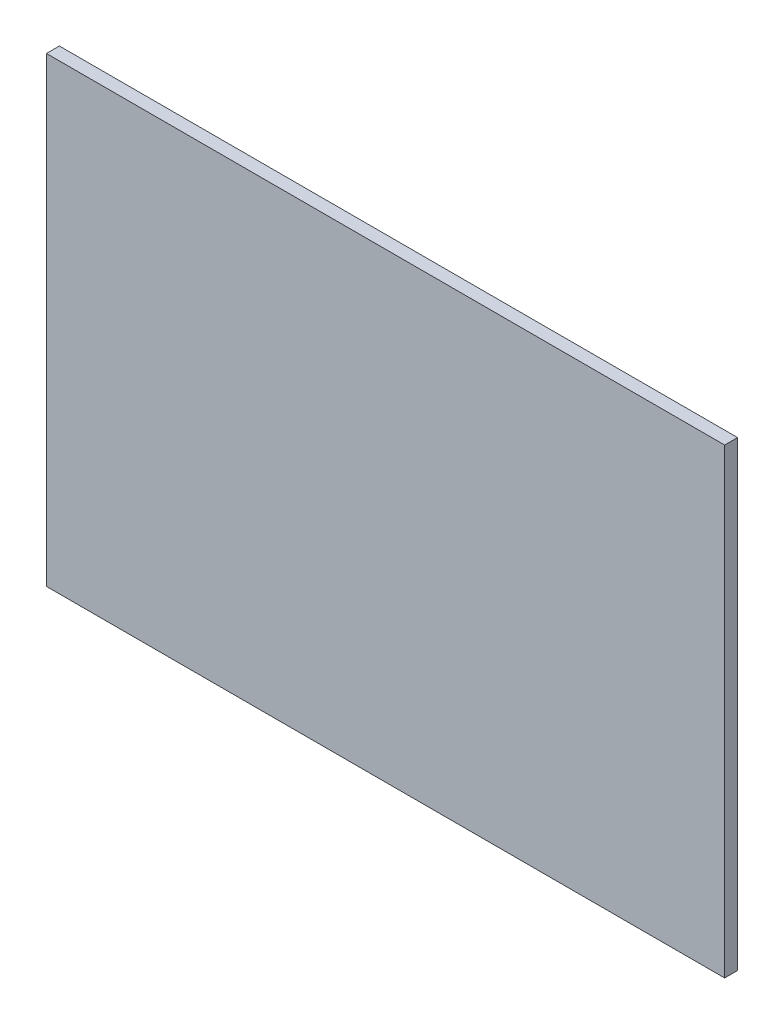
from build123d import *

# Parameters (mm, degrees)
SKETCH1_W           = 1000
SKETCH1_H           = 680.6
BOSS_EXTRUDE1_DEPTH = 19.05


with BuildPart() as part:
    # Sketch1 → Boss-Extrude1 (new body)
    with BuildSketch(Plane.XY):
        with Locations((-170, 373)):
            Rectangle(SKETCH1_W, SKETCH1_H)
    extrude(amount=BOSS_EXTRUDE1_DEPTH)


solid = part.part
